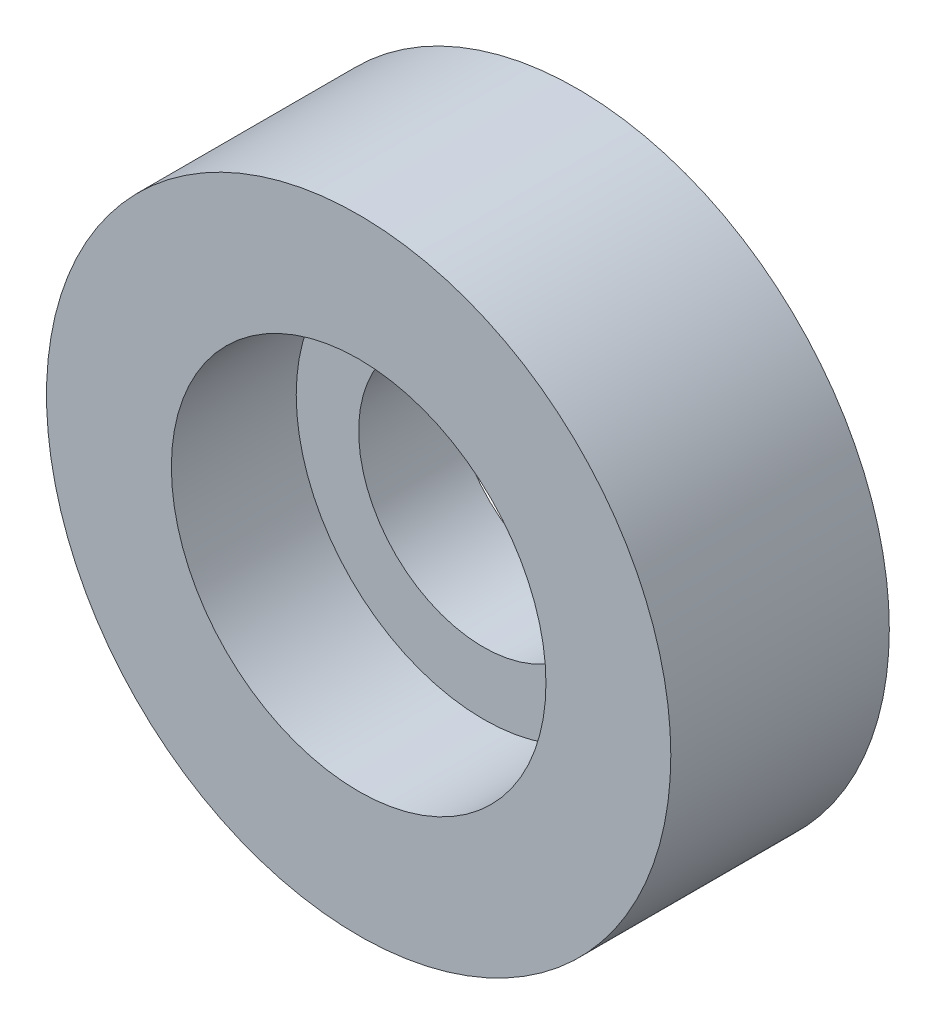
from build123d import *

# Parameters (mm, degrees)
SKETCH1_R           = 5
SKETCH1_R_2         = 2
BOSS_EXTRUDE1_DEPTH = 1.5
SKETCH2_R           = 5
SKETCH2_R_2         = 3
BOSS_EXTRUDE2_DEPTH = 2


with BuildPart() as part:
    # Sketch1 → Boss-Extrude1 (new body)
    with BuildSketch(Plane.XY):
        Circle(SKETCH1_R)
        Circle(SKETCH1_R_2, mode=Mode.SUBTRACT)
    extrude(amount=BOSS_EXTRUDE1_DEPTH)

    # Sketch2 → Boss-Extrude2 (add)
    with BuildSketch(Plane.XY.offset(1.5)):
        Circle(SKETCH2_R)
        Circle(SKETCH2_R_2, mode=Mode.SUBTRACT)
    extrude(amount=BOSS_EXTRUDE2_DEPTH)


solid = part.part
